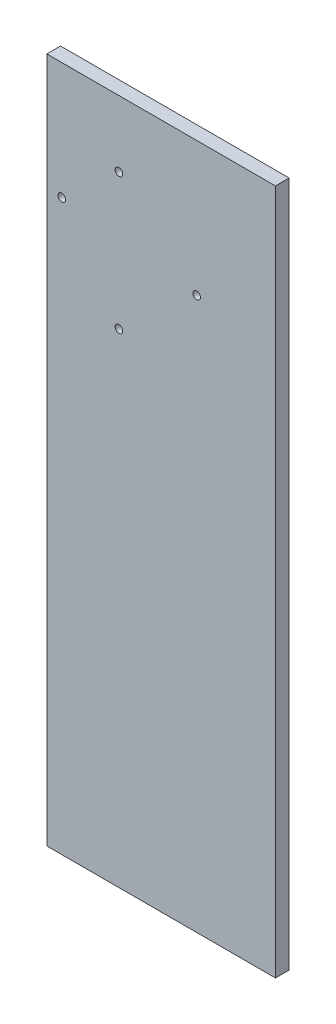
from build123d import *

# Parameters (mm, degrees)
SKETCH1_W                      = 150
SKETCH1_H                      = 9
BOSS_EXTRUDE1_DEPTH            = 450
CUT_EXTRUDE1_REACH             = 458.296
SKETCH2_R                      = 2.5
CUT_EXTRUDE1_DIRECTION_2_DEPTH = 457.29595659


with BuildPart() as part:
    # Sketch1 → Boss-Extrude1 (new body)
    with BuildSketch(Plane(origin=(0, 0, 0), x_dir=(1, 0, 0), z_dir=(0, 1, 0))):
        Rectangle(SKETCH1_W, SKETCH1_H)
    extrude(amount=BOSS_EXTRUDE1_DEPTH)

    # Sketch2 → Cut-Extrude1 (cut, up to next)
    with BuildSketch(Plane.XY.offset(4.5), mode=Mode.PRIVATE) as cut_extrude1_sk1:
        with Locations(Location((-27.7, 406.6, 0), (0, 0, 180))):
            Circle(SKETCH2_R)
    cut_extrude1_tool1 = extrude(cut_extrude1_sk1.sketch, amount=-CUT_EXTRUDE1_REACH, mode=Mode.PRIVATE) & part.part
    # Sketch2 → Cut-Extrude1 (cut, up to next)
    with BuildSketch(Plane.XY.offset(4.5), mode=Mode.PRIVATE) as cut_extrude1_sk2:
        with Locations(Location((-27.7, 317.4, 0), (0, 0, 180))):
            Circle(SKETCH2_R)
    cut_extrude1_tool2 = extrude(cut_extrude1_sk2.sketch, amount=-CUT_EXTRUDE1_REACH, mode=Mode.PRIVATE) & part.part
    # Sketch2 → Cut-Extrude1 (cut, up to next)
    with BuildSketch(Plane.XY.offset(4.5), mode=Mode.PRIVATE) as cut_extrude1_sk3:
        with Locations(Location((23.3, 362, 0), (0, 0, 180))):
            Circle(SKETCH2_R)
    cut_extrude1_tool3 = extrude(cut_extrude1_sk3.sketch, amount=-CUT_EXTRUDE1_REACH, mode=Mode.PRIVATE) & part.part
    # Sketch2 → Cut-Extrude1 (cut, up to next)
    with BuildSketch(Plane.XY.offset(4.5), mode=Mode.PRIVATE) as cut_extrude1_sk4:
        with Locations(Location((-65.2, 373.3, 0), (0, 0, 180))):
            Circle(SKETCH2_R)
    cut_extrude1_tool4 = extrude(cut_extrude1_sk4.sketch, amount=-CUT_EXTRUDE1_REACH, mode=Mode.PRIVATE) & part.part
    add(cut_extrude1_tool1.solids().sort_by_distance((-27.7, 406.6, 4.5))[0], mode=Mode.SUBTRACT)
    add(cut_extrude1_tool2.solids().sort_by_distance((-27.7, 317.4, 4.5))[0], mode=Mode.SUBTRACT)
    add(cut_extrude1_tool3.solids().sort_by_distance((23.3, 362, 4.5))[0], mode=Mode.SUBTRACT)
    add(cut_extrude1_tool4.solids().sort_by_distance((-65.2, 373.3, 4.5))[0], mode=Mode.SUBTRACT)

    # Sketch2 → Cut-Extrude1 direction 2 (cut)
    with BuildSketch(Plane.XY.offset(4.5)):
        with Locations(Location((-27.7, 406.6, 0), (0, 0, 180))):
            Circle(SKETCH2_R)
        with Locations(Location((-27.7, 317.4, 0), (0, 0, 180))):
            Circle(SKETCH2_R)
        with Locations(Location((23.3, 362, 0), (0, 0, 180))):
            Circle(SKETCH2_R)
        with Locations(Location((-65.2, 373.3, 0), (0, 0, 180))):
            Circle(SKETCH2_R)
    extrude(amount=CUT_EXTRUDE1_DIRECTION_2_DEPTH, mode=Mode.SUBTRACT)


solid = part.part
